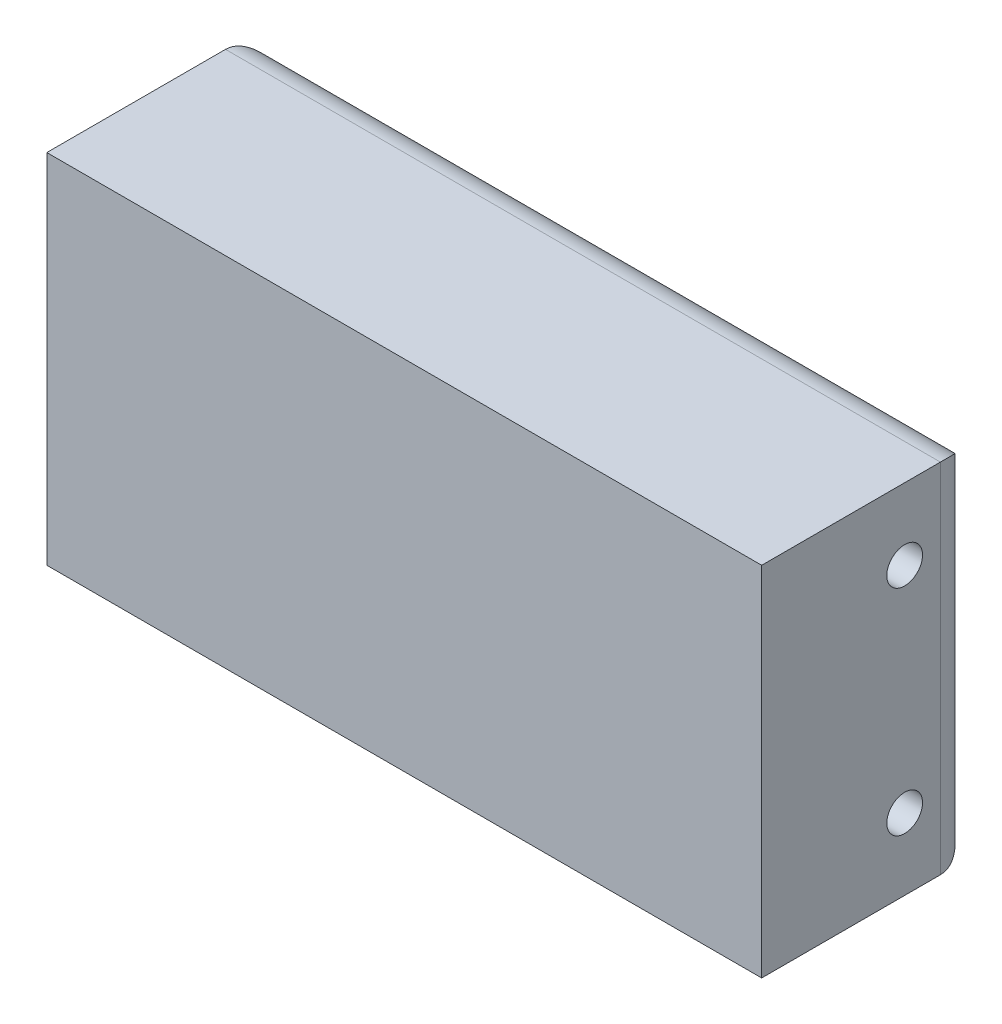
from build123d import *

# Parameters (mm, degrees)
SKETCH1_W               = 100
SKETCH1_H               = 50
BOSS_EXTRUDE1_DEPTH     = 30
SKETCH2_R               = 2.5
CUT_EXTRUDE1_DEPTH      = 108.354552768
FILLET1_R               = 5
CUT_EXTRUDE2_REACH      = 65.443
CUT_EXTRUDE2_END_RADIUS = 2.5
SKETCH3_R               = 2.5


with BuildPart() as part:
    # Sketch1 → Boss-Extrude1 (new body)
    with BuildSketch(Plane.XY):
        Rectangle(SKETCH1_W, SKETCH1_H)
    extrude(amount=BOSS_EXTRUDE1_DEPTH)

    # Sketch2 → Cut-Extrude1 (cut, through all)
    with BuildSketch(Plane(origin=(50, 0, 0), x_dir=(0, 0, -1), z_dir=(1, 0, 0))):
        with Locations(Location((-10, 15, 0), (0, 0, 90))):
            Circle(SKETCH2_R)
        with Locations(Location((-10, -15, 0), (0, 0, 90))):
            Circle(SKETCH2_R)
    extrude(amount=-CUT_EXTRUDE1_DEPTH, mode=Mode.SUBTRACT)

    # Fillet1
    fillet1_edges = [part.edges().sort_by_distance(p)[0] for p in [
        (0, -25, 0),
        (-50, 0, 0),
        (0, 25, 0),
        (50, 0, 0),
    ]]
    fillet(fillet1_edges, radius=FILLET1_R)

    # Cut-Extrude2: up to this cylinder (the profile starts outside it)
    cut_extrude2_end = Plane(origin=(0, 15, 10), z_dir=(1, 0, 0)) * Cylinder(CUT_EXTRUDE2_END_RADIUS, 196.886, mode=Mode.PRIVATE)
    # Sketch3 → Cut-Extrude2 (cut, up to the surface)
    with BuildSketch(Plane(origin=(0, 0, 0), x_dir=(-1, 0, 0), z_dir=(0, 0, -1)), mode=Mode.PRIVATE) as cut_extrude2_sk1:
        with Locations((-30, 15)):
            Circle(SKETCH3_R)
    cut_extrude2_tool1 = extrude(cut_extrude2_sk1.sketch, amount=-CUT_EXTRUDE2_REACH, mode=Mode.PRIVATE) - cut_extrude2_end
    add(cut_extrude2_tool1.solids().sort_by_distance((30, 15, 0))[0], mode=Mode.SUBTRACT)
    # Sketch3 → Cut-Extrude2 (cut, up to the surface)
    with BuildSketch(Plane(origin=(0, 0, 0), x_dir=(-1, 0, 0), z_dir=(0, 0, -1)), mode=Mode.PRIVATE) as cut_extrude2_sk2:
        with Locations((30, 15)):
            Circle(SKETCH3_R)
    cut_extrude2_tool2 = extrude(cut_extrude2_sk2.sketch, amount=-CUT_EXTRUDE2_REACH, mode=Mode.PRIVATE) - cut_extrude2_end
    add(cut_extrude2_tool2.solids().sort_by_distance((-30, 15, 0))[0], mode=Mode.SUBTRACT)
    # Sketch3 → Cut-Extrude2 (cut, up to the surface)
    with BuildSketch(Plane(origin=(0, 0, 0), x_dir=(-1, 0, 0), z_dir=(0, 0, -1)), mode=Mode.PRIVATE) as cut_extrude2_sk3:
        with Locations((0, 15)):
            Circle(SKETCH3_R)
    cut_extrude2_tool3 = extrude(cut_extrude2_sk3.sketch, amount=-CUT_EXTRUDE2_REACH, mode=Mode.PRIVATE) - cut_extrude2_end
    add(cut_extrude2_tool3.solids().sort_by_distance((0, 15, 0))[0], mode=Mode.SUBTRACT)


solid = part.part
